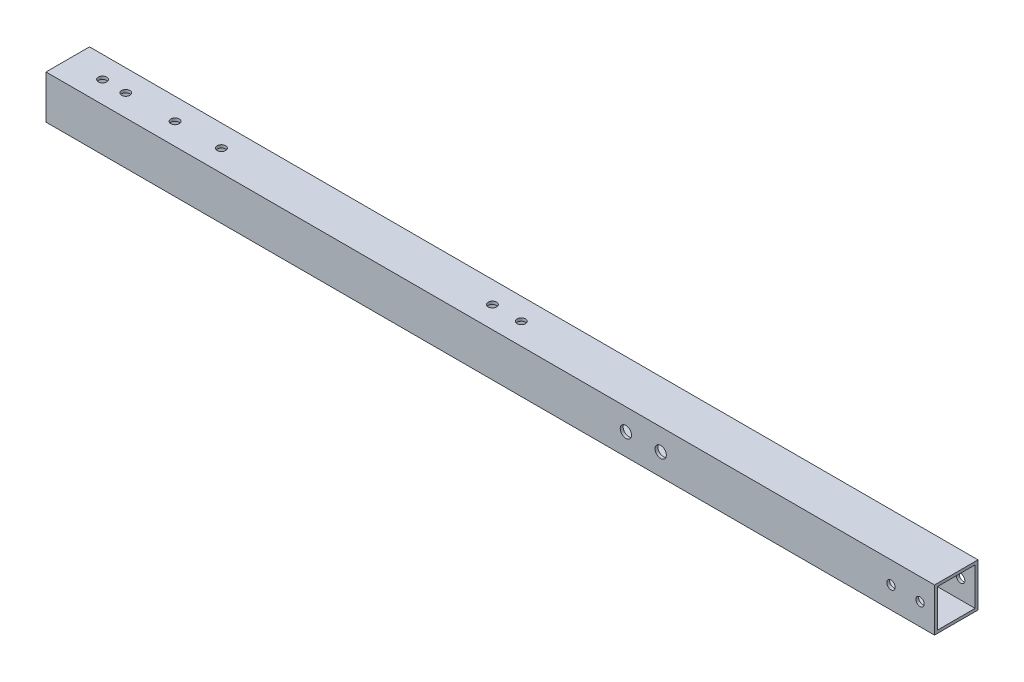
from build123d import *

# Parameters (mm, degrees)
SKETCH_1_W          = 15
SKETCH_1_H          = 15
SKETCH_1_W_2        = 13
SKETCH_1_H_2        = 13
EXTRUDE_1_DEPTH     = 306.44
SKETCH_2_R          = 1.45
CUT_EXTRUDE_1_DEPTH = 307.898555878
SKETCH_3_R          = 1.45
SKETCH_3_R_2        = 1.95
CUT_EXTRUDE_2_DEPTH = 307.898555878


with BuildPart() as part:
    # 草图1 → 凸台-拉伸1 (new body)
    with BuildSketch(Plane(origin=(0, 0, 0), x_dir=(0, 0, -1), z_dir=(1, 0, 0))):
        Rectangle(SKETCH_1_W, SKETCH_1_H)
        Rectangle(SKETCH_1_W_2, SKETCH_1_H_2, mode=Mode.SUBTRACT)
    extrude(amount=EXTRUDE_1_DEPTH)

    # 草图2 → 切除-拉伸1 (cut, through all)
    with BuildSketch(Plane(origin=(0, 7.5, 0), x_dir=(1, 0, 0), z_dir=(0, 1, 0))):
        with Locations(Location((20, 0, 0), (0, 0, 270))):
            Circle(SKETCH_2_R)
        with Locations(Location((12, 0, 0), (0, 0, 270))):
            Circle(SKETCH_2_R)
        with Locations(Location((37, 0, 0), (0, 0, 270))):
            Circle(SKETCH_2_R)
        with Locations(Location((53, 0, 0), (0, 0, 270))):
            Circle(SKETCH_2_R)
        with Locations(Location((156.44, 0, 0), (0, 0, 270))):
            Circle(SKETCH_2_R)
        with Locations(Location((146.44, 0, 0), (0, 0, 270))):
            Circle(SKETCH_2_R)
    extrude(amount=-CUT_EXTRUDE_1_DEPTH, mode=Mode.SUBTRACT)

    # 草图3 → 切除-拉伸2 (cut, through all)
    with BuildSketch(Plane.XY.offset(7.5)):
        with Locations((301.44, 0)):
            Circle(SKETCH_3_R)
        with Locations((291.44, 0)):
            Circle(SKETCH_3_R)
        with Locations((200, 0)):
            Circle(SKETCH_3_R_2)
        with Locations((212, 0)):
            Circle(SKETCH_3_R_2)
    extrude(amount=-CUT_EXTRUDE_2_DEPTH, mode=Mode.SUBTRACT)


solid = part.part
